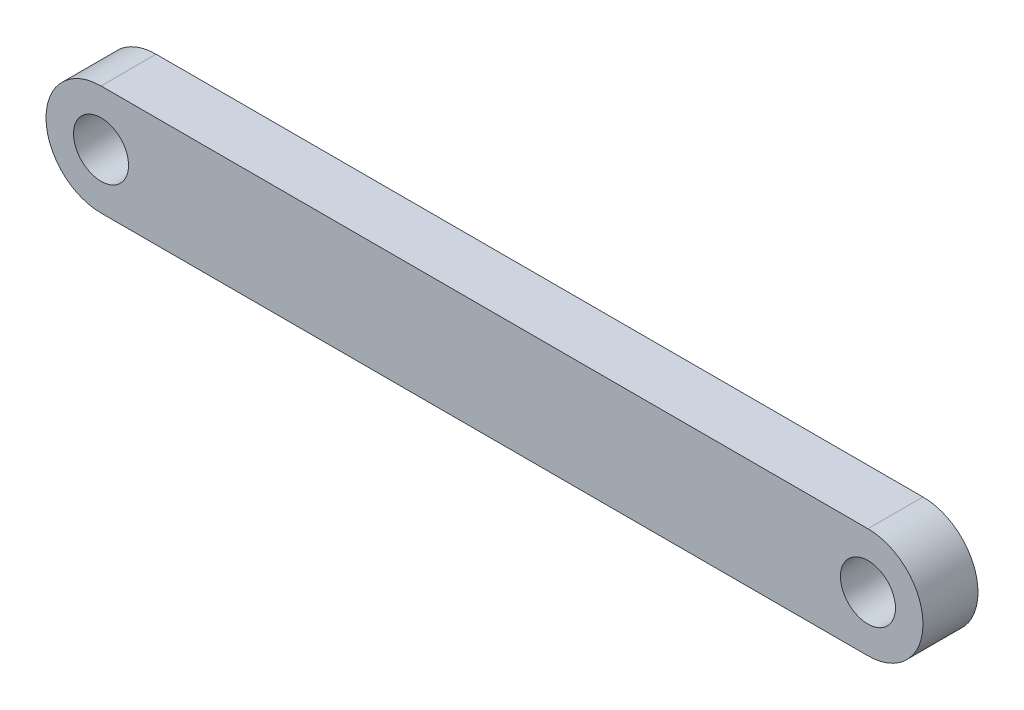
from build123d import *

# Parameters (mm, degrees)
ESBO_O1_R                = 2.5
RESSALTO_EXTRUS_O1_DEPTH = 5


with BuildPart() as part:
    # Esboço1 → Ressalto-extrusão1 (new body)
    with BuildSketch(Plane.XY):
        with BuildLine():
            Line((-34.84, 5), (34.84, 5))
            ThreePointArc((34.84, 5), (39.84, 0), (34.84, -5))
            Line((34.84, -5), (-34.84, -5))
            ThreePointArc((-34.84, -5), (-39.84, 0), (-34.84, 5))
        make_face()
        with Locations((-34.84, 0)):
            Circle(ESBO_O1_R, mode=Mode.SUBTRACT)
        with Locations((34.84, 0)):
            Circle(ESBO_O1_R, mode=Mode.SUBTRACT)
    extrude(amount=RESSALTO_EXTRUS_O1_DEPTH)


solid = part.part
